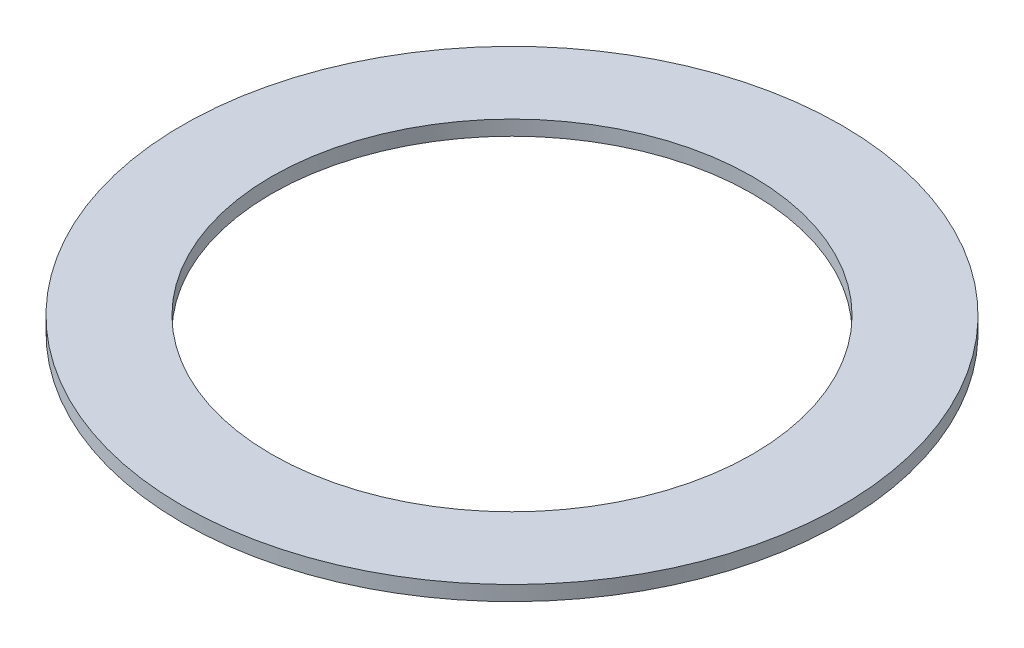
from build123d import *

# Parameters (mm, degrees)
SKETCH1_R           = 11.1
SKETCH1_R_2         = 8.1
BOSS_EXTRUDE1_DEPTH = 0.5


with BuildPart() as part:
    # Sketch1 → Boss-Extrude1 (new body)
    with BuildSketch(Plane(origin=(0, 0, 0), x_dir=(1, 0, 0), z_dir=(0, 1, 0))):
        with Locations(Location((0, 0, 0), (0, 0, 270))):
            Circle(SKETCH1_R)
        with Locations(Location((0, 0, 0), (0, 0, 270))):
            Circle(SKETCH1_R_2, mode=Mode.SUBTRACT)
    extrude(amount=BOSS_EXTRUDE1_DEPTH)


solid = part.part
